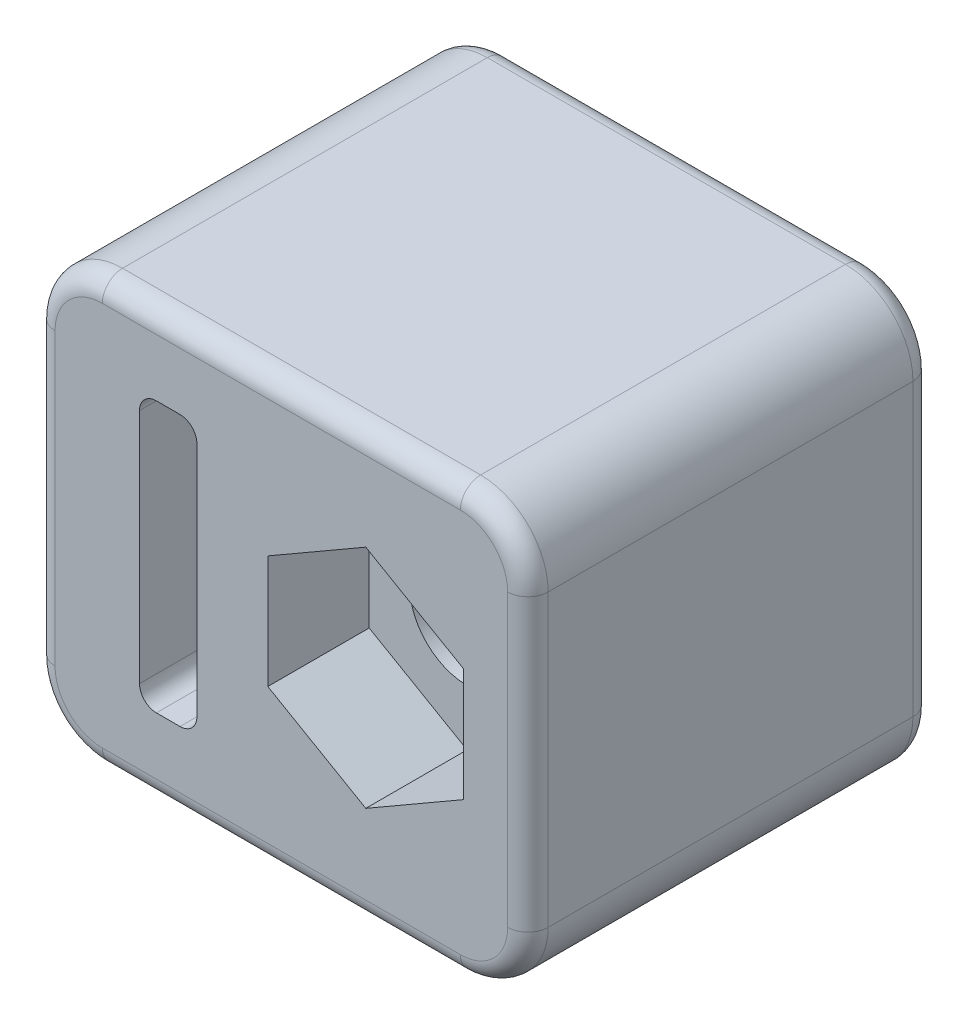
from build123d import *

# Parameters (mm, degrees)
SKETCH1_R           = 1.7
BOSS_EXTRUDE1_DEPTH = 12
CUT_EXTRUDE1_DEPTH  = 3
CUT_EXTRUDE2_DEPTH  = 6
FILLET1_R           = 0.6


with BuildPart() as part:
    # Sketch1 → Boss-Extrude1 (new body)
    with BuildSketch(Plane.XY):
        with BuildLine():
            Line((2, 0), (12.6, 0))
            ThreePointArc((12.6, 0), (14.014213562, 0.585786438), (14.6, 2))
            Line((14.6, 2), (14.6, 10.6))
            ThreePointArc((14.6, 10.6), (14.014213562, 12.014213562), (12.6, 12.6))
            Line((12.6, 12.6), (2, 12.6))
            ThreePointArc((2, 12.6), (0.585786438, 12.014213562), (0, 10.6))
            Line((0, 10.6), (0, 2))
            ThreePointArc((0, 2), (0.585786438, 0.585786438), (2, 0))
        make_face()
        with Locations((9.8, 6.3)):
            Circle(SKETCH1_R, mode=Mode.SUBTRACT)
        with BuildLine():
            Line((3.1, 9.8), (3.1, 2.8))
            ThreePointArc((3.1, 2.8), (3.246446609, 2.446446609), (3.6, 2.3))
            Line((3.6, 2.3), (4.3, 2.3))
            ThreePointArc((4.3, 2.3), (4.653553391, 2.446446609), (4.8, 2.8))
            Line((4.8, 2.8), (4.8, 9.8))
            ThreePointArc((4.8, 9.8), (4.653553391, 10.153553391), (4.3, 10.3))
            Line((4.3, 10.3), (3.6, 10.3))
            ThreePointArc((3.6, 10.3), (3.246446609, 10.153553391), (3.1, 9.8))
        make_face(mode=Mode.SUBTRACT)
    extrude(amount=BOSS_EXTRUDE1_DEPTH)

    # Sketch2 → Cut-Extrude1 (cut)
    with BuildSketch(Plane.XY.offset(12)):
        Polygon((9.8, 9.648631561), (6.9, 7.974315781), (6.9, 4.625684219), (9.8, 2.951368439), (12.7, 4.625684219), (12.7, 7.974315781), align=None)
    extrude(amount=-CUT_EXTRUDE1_DEPTH, mode=Mode.SUBTRACT)

    # Sketch3 → Cut-Extrude2 (cut)
    with BuildSketch(Plane(origin=(0, 0, 0), x_dir=(-1, 0, 0), z_dir=(0, 0, -1))):
        with BuildLine():
            Line((-4.8, 9.8), (-4.8, 2.8))
            ThreePointArc((-4.8, 2.8), (-4.653553391, 2.446446609), (-4.3, 2.3))
            Line((-4.3, 2.3), (-2.8, 2.3))
            ThreePointArc((-2.8, 2.3), (-2.446446609, 2.446446609), (-2.3, 2.8))
            Line((-2.3, 2.8), (-2.3, 9.8))
            ThreePointArc((-2.3, 9.8), (-2.446446609, 10.153553391), (-2.8, 10.3))
            Line((-2.8, 10.3), (-4.3, 10.3))
            ThreePointArc((-4.3, 10.3), (-4.653553391, 10.153553391), (-4.8, 9.8))
        make_face()
    extrude(amount=-CUT_EXTRUDE2_DEPTH, mode=Mode.SUBTRACT)

    # Fillet1
    fillet1_edges = [part.edges().sort_by_distance(p)[0] for p in [
        (0, 6.3, 0),
        (0.585786438, 12.014213562, 0),
        (7.3, 12.6, 0),
        (14.014213562, 12.014213562, 0),
        (0.585786438, 12.014213562, 12),
        (0, 6.3, 12),
        (0.585786438, 0.585786438, 12),
        (7.3, 0, 12),
        (14.014213562, 0.585786438, 12),
        (14.6, 6.3, 12),
        (14.014213562, 12.014213562, 12),
        (14.6, 6.3, 0),
        (7.3, 12.6, 12),
        (14.014213562, 0.585786438, 0),
        (7.3, 0, 0),
        (0.585786438, 0.585786438, 0),
    ]]
    fillet(fillet1_edges, radius=FILLET1_R)


solid = part.part
